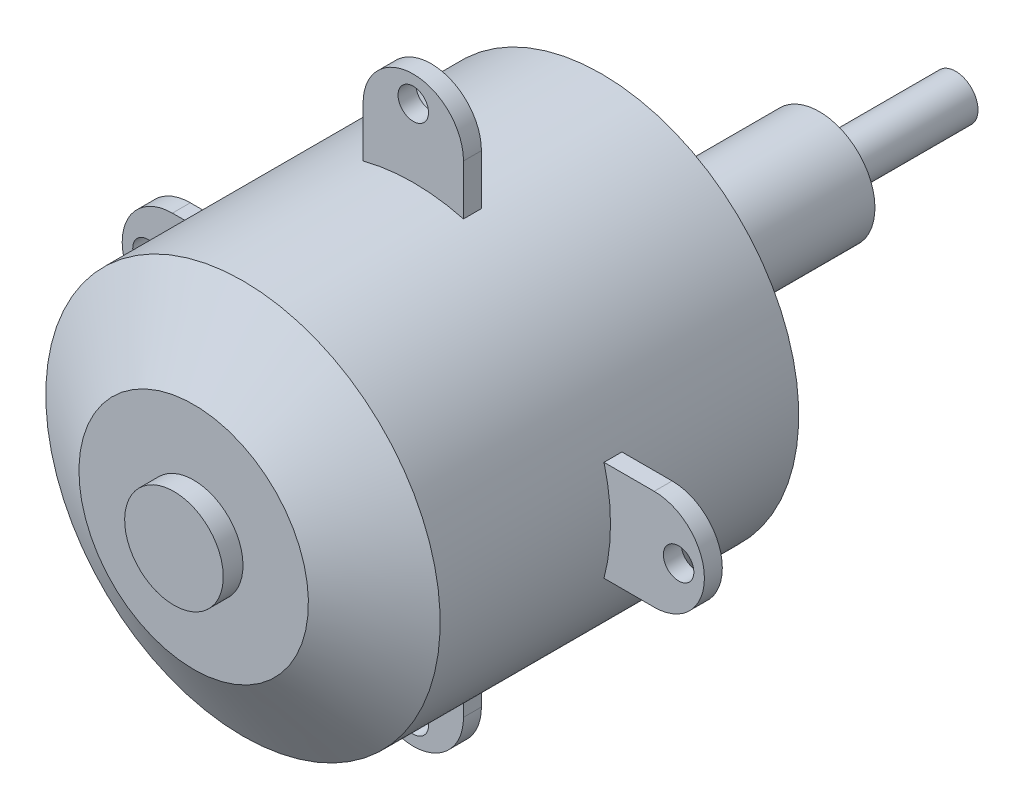
from build123d import *

# Parameters (mm, degrees)
SKETCH3_R           = 1.0795
BOSS_EXTRUDE2_DEPTH = 0.635
CIRPATTERN1_COUNT   = 4


with BuildPart() as part:
    # Sketch2 → Revolve1 (revolve)
    with BuildSketch(Plane(origin=(0, 0, 0), x_dir=(0, 0, -1), z_dir=(1, 0, 0))):
        Polygon((-17.5895, 0), (37.7825, 0), (37.7825, 1.5875), (28.1305, 1.5875), (28.1305, 3.937), (16.1925, 3.937), (16.1925, 8.128), (12.7, 13.97), (-12.7, 13.97), (-16.1925, 8.128), (-16.1925, 3.4925), (-17.5895, 3.4925), align=None)
    revolve(axis=Axis((0, 0, 16.1925), (0, 0, -1)))

    # Sketch3 → Boss-Extrude2 (add, symmetric)
    with BuildSketch(Plane.XY):
        with BuildLine():
            Line((-3.556, 17.065839525), (-3.556, 13.509839525))
            ThreePointArc((-3.556, 13.509839525), (0, 13.97), (3.556, 13.509839525))
            Line((3.556, 13.509839525), (3.556, 17.065839525))
            ThreePointArc((3.556, 17.065839525), (2.514471721, 19.580311232), (2.1e-08, 20.621839525))
            ThreePointArc((2.1e-08, 20.621839525), (-2.514471707, 19.580311247), (-3.556, 17.065839525))
        make_face()
        with Locations((0, 18.796)):
            Circle(SKETCH3_R, mode=Mode.SUBTRACT)
    boss_extrude2 = extrude(amount=BOSS_EXTRUDE2_DEPTH, both=True)

    # CirPattern1: Boss-Extrude2 ×4 about axis
    cirpattern1_axis = Axis((0, 0, -12.7), (0, 0, 1))
    for i in range(1, CIRPATTERN1_COUNT):
        add(boss_extrude2.rotate(cirpattern1_axis, i * 360 / CIRPATTERN1_COUNT))


solid = part.part
